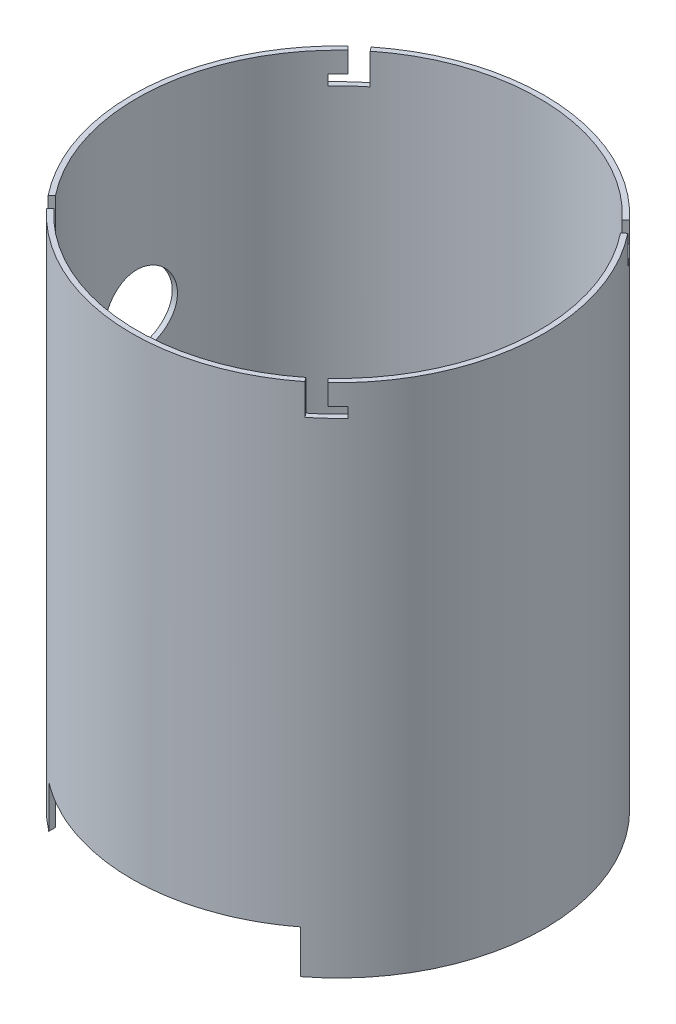
from build123d import *

# Parameters (mm, degrees)
SKETCH_1_R                  = 200
SKETCH_1_R_2                = 195
EXTRUDE_339_DEPTH           = 500
CUT_EXTRUDE_START           = -127.878338
SKETCH_8_W                  = 244
SKETCH_8_H                  = 41.8
CUT_EXTRUDE_600_DEPTH       = 47.878338
SKETCH_9_R                  = 36
CUT_EXTRUDE_1494_DEPTH      = 575.456264654
CUT_EXTRUDE_1675_REACH      = 576.456
CUT_EXTRUDE_1675_END_RADIUS = 200
SKETCH_10_R                 = 36
SKETCH_14_W                 = 24.14269203
SKETCH_14_H                 = 10
CUT_REVOLVE_1_ANGLE         = 8.5
CUT_EXTRUDE_1_REACH         = 559.136
PATTERN_CIRCULAR_1_COUNT    = 4


with BuildPart() as part:
    # 草图1 → Extrude 339 (new body)
    with BuildSketch(Plane(origin=(0, 0, 0), x_dir=(1, 0, 0), z_dir=(0, 1, 0))):
        with Locations(Location((0, 0, 0), (0, 0, 270))):
            Circle(SKETCH_1_R)
        with Locations(Location((0, 0, 0), (0, 0, 270))):
            Circle(SKETCH_1_R_2, mode=Mode.SUBTRACT)
    extrude(amount=EXTRUDE_339_DEPTH)

    # 草图8 → Cut-Extrude 600 (cut)
    with BuildSketch(Plane.XY.offset(280).offset(CUT_EXTRUDE_START)):
        with Locations((0, 20.9)):
            Rectangle(SKETCH_8_W, SKETCH_8_H)
    extrude(amount=CUT_EXTRUDE_600_DEPTH, mode=Mode.SUBTRACT)

    # 草图9 → Cut-Extrude 1494 (cut, through all)
    with BuildSketch(Plane(origin=(0, 0, 0), x_dir=(0, 0, -1), z_dir=(1, 0, 0))):
        with Locations((0, 180)):
            Circle(SKETCH_9_R)
    extrude(amount=-CUT_EXTRUDE_1494_DEPTH, mode=Mode.SUBTRACT)

    # Cut-Extrude 1675: up to this cylinder (the profile starts inside it)
    cut_extrude_1675_end = Plane(origin=(0, 320, 0), z_dir=(0, -1, 0)) * Cylinder(CUT_EXTRUDE_1675_END_RADIUS, 1553.912, mode=Mode.PRIVATE)
    # 草图10 → Cut-Extrude 1675 (cut, up to the surface)
    with BuildSketch(Plane(origin=(0, 0, 0), x_dir=(0, 0, -1), z_dir=(1, 0, 0)), mode=Mode.PRIVATE) as cut_extrude_1675_sk1:
        with Locations((0, 320)):
            Circle(SKETCH_10_R)
    cut_extrude_1675_tool1 = extrude(cut_extrude_1675_sk1.sketch, amount=-CUT_EXTRUDE_1675_REACH, mode=Mode.PRIVATE) & cut_extrude_1675_end
    add(cut_extrude_1675_tool1.solids().sort_by_distance((0, 320, 0))[0], mode=Mode.SUBTRACT)

    # 草图14 → 切除-旋转1 (revolve, cut)
    with BuildSketch(Plane(origin=(0, 0, 0), x_dir=(0.7313537016191752, 0, 0.6819983600624934), z_dir=(-0.6819983600624934, 0, 0.7313537016191752))):
        with Locations((-187.928653985, 475)):
            Rectangle(SKETCH_14_W, SKETCH_14_H)
    cut_revolve_1 = revolve(axis=Axis((0, -25.014655285, 0), (0, -1, 0)), revolution_arc=CUT_REVOLVE_1_ANGLE, mode=Mode.SUBTRACT)

    # 草图16 → 切除-拉伸1 (cut, up to next)
    with BuildSketch(Plane.XZ.offset(-480), mode=Mode.PRIVATE) as cut_extrude_1_sk1:
        with BuildLine():
            Line((-124.502927328, -156.52163137), (-121.390354144, -152.608590586))
            ThreePointArc((-121.390354144, -152.608590586), (-127.28815173, -147.725171955), (-132.989680212, -142.613971816))
            Line((-132.989680212, -142.613971816), (-136.399672013, -146.270740324))
            ThreePointArc((-136.399672013, -146.270740324), (-130.551950493, -151.512996877), (-124.502927328, -156.52163137))
        make_face()
    cut_extrude_1_tool1 = extrude(cut_extrude_1_sk1.sketch, amount=-CUT_EXTRUDE_1_REACH, mode=Mode.PRIVATE) & part.part
    cut_extrude_1 = cut_extrude_1_tool1.solids().sort_by_distance((-128.893802, 480, -149.588621))[0]
    add(cut_extrude_1, mode=Mode.SUBTRACT)

    # 阵列(圆周)1: 切除-旋转1, 切除-拉伸1 ×4 about axis
    pattern_circular_1_axis = Axis((0, -25.014655285, 0), (0, 1, 0))
    add([cut_revolve_1.rotate(pattern_circular_1_axis, i * 360 / PATTERN_CIRCULAR_1_COUNT) for i in range(1, PATTERN_CIRCULAR_1_COUNT)], mode=Mode.SUBTRACT)
    add([cut_extrude_1.rotate(pattern_circular_1_axis, i * 360 / PATTERN_CIRCULAR_1_COUNT) for i in range(1, PATTERN_CIRCULAR_1_COUNT)], mode=Mode.SUBTRACT)


solid = part.part
